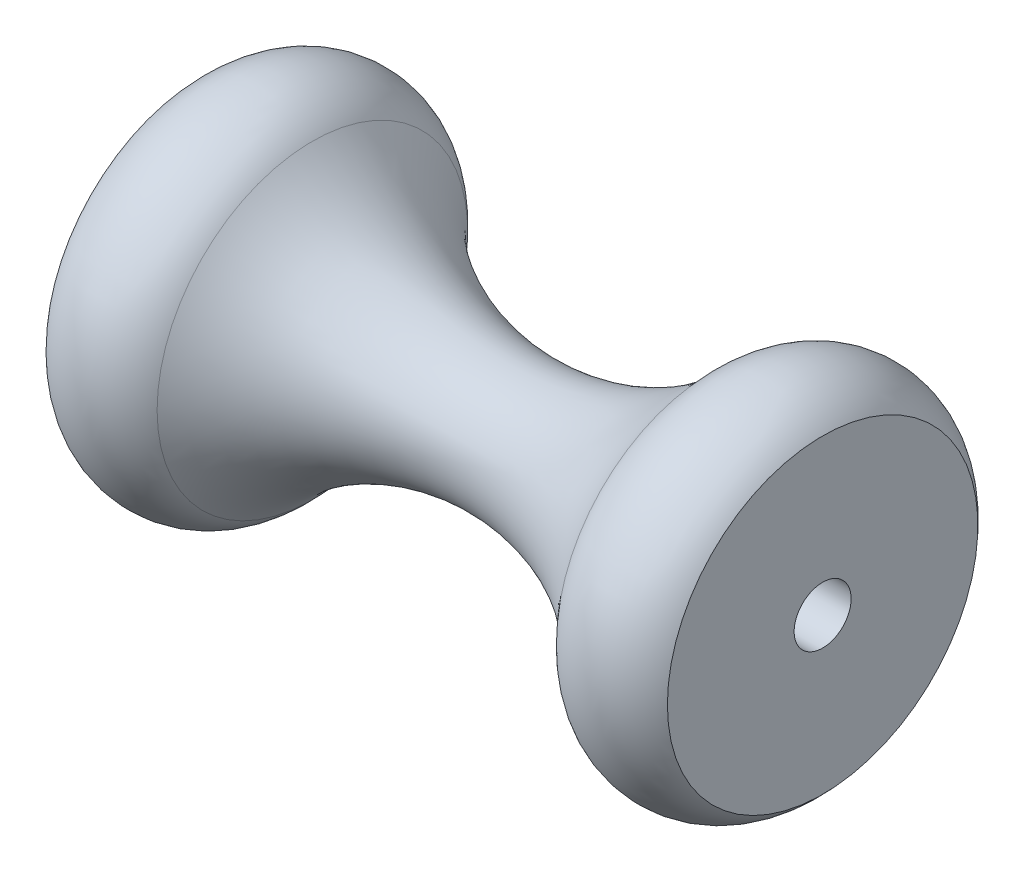
from build123d import *

# Parameters (mm, degrees)
SKETCH2_R          = 2.294127532
CUT_EXTRUDE1_DEPTH = 55.083687145


with BuildPart() as part:
    # Sketch1 → Revolve1 (revolve)
    with BuildSketch(Plane.XY, mode=Mode.PRIVATE) as revolve1_sk:
        with BuildLine():
            Line((-25, 0), (25, 0))
            Line((25, 0), (25, -12.5))
            ThreePointArc((25, -12.5), (20.542853971, -14.578155052), (16.085707942, -12.5))
            ThreePointArc((16.085707942, -12.5), (0, -5), (-16.085707942, -12.5))
            ThreePointArc((-16.085707942, -12.5), (-20.542853971, -14.578155052), (-25, -12.5))
            Line((-25, -12.5), (-25, 0))
        make_face()
    revolve(revolve1_sk.sketch.rotate(Axis((-25, 0, 0), (1, 0, 0)), 270), axis=Axis((-25, 0, 0), (1, 0, 0)))

    # Sketch2 → Cut-Extrude1 (cut, through all)
    with BuildSketch(Plane(origin=(25, 0, 0), x_dir=(0, 0, -1), z_dir=(1, 0, 0))):
        Circle(SKETCH2_R)
    extrude(amount=-CUT_EXTRUDE1_DEPTH, mode=Mode.SUBTRACT)


solid = part.part
